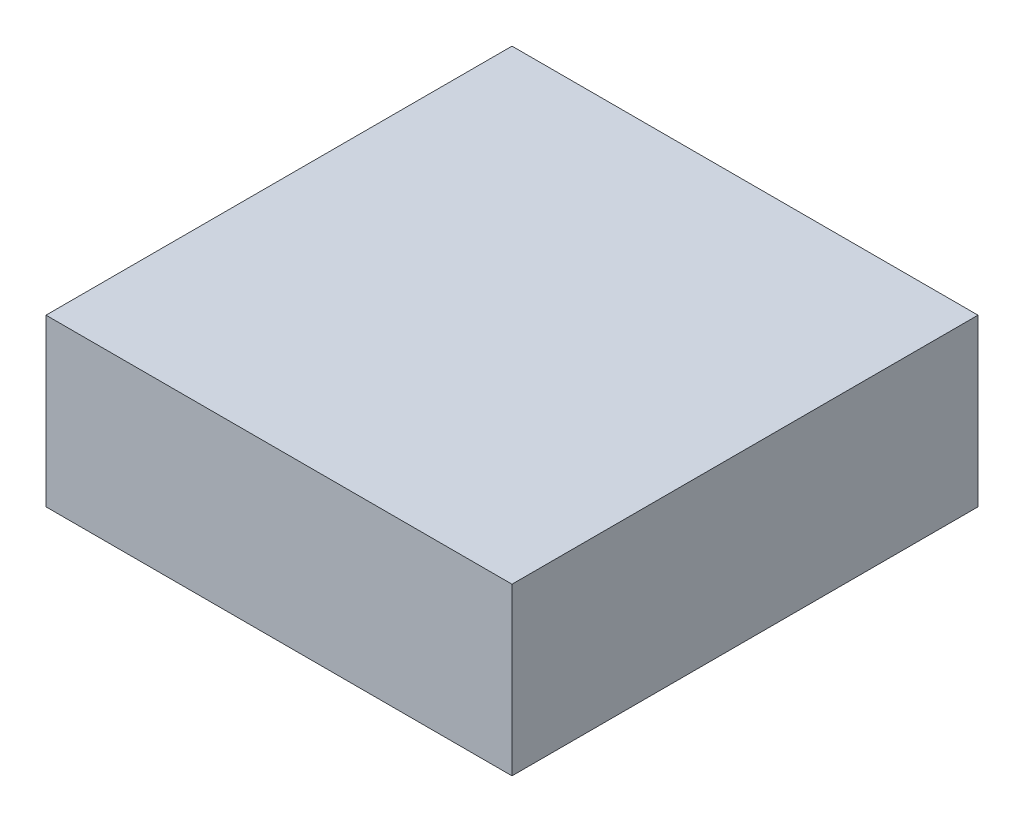
from build123d import *

# Parameters (mm, degrees)
SKETCH1_W           = 254
SKETCH1_H           = 254
BOSS_EXTRUDE1_DEPTH = 90.4875


with BuildPart() as part:
    # Sketch1 → Boss-Extrude1 (new body)
    with BuildSketch(Plane(origin=(0, 0, 0), x_dir=(1, 0, 0), z_dir=(0, 1, 0))):
        with Locations((77.789687988, 93.629998818)):
            Rectangle(SKETCH1_W, SKETCH1_H)
    extrude(amount=BOSS_EXTRUDE1_DEPTH)


solid = part.part
